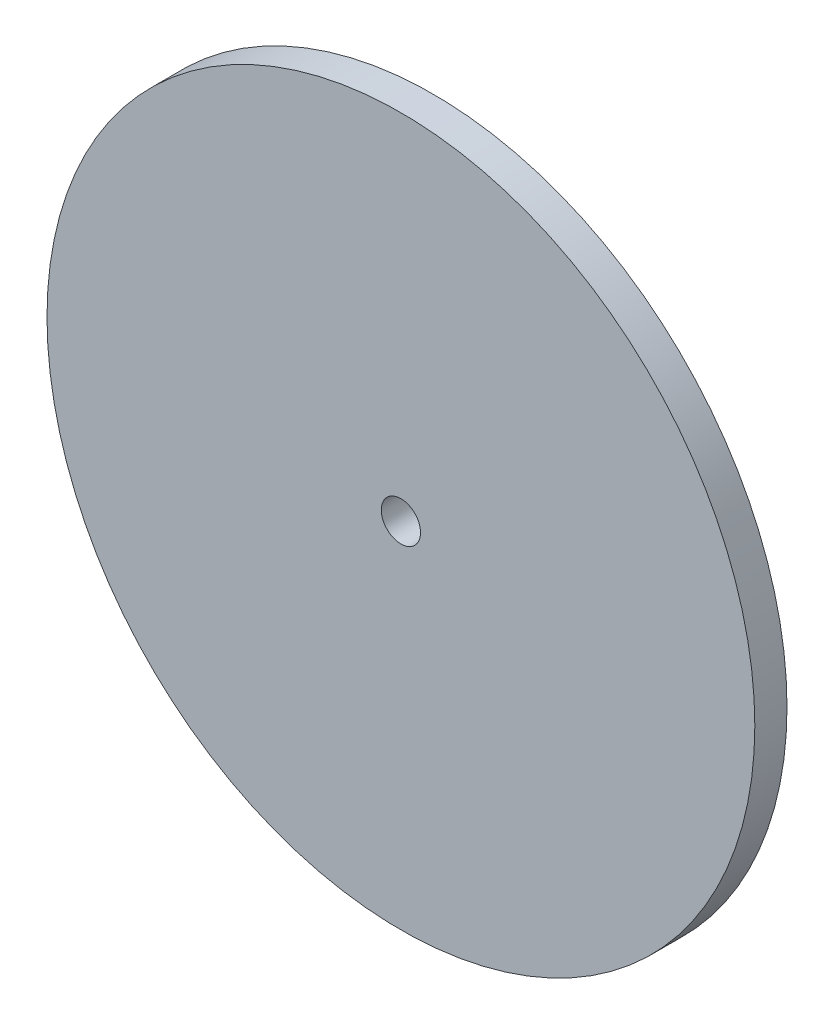
from build123d import *

# Parameters (mm, degrees)
SKETCH1_R           = 55
SKETCH1_R_2         = 3.05
BOSS_EXTRUDE1_DEPTH = 5


with BuildPart() as part:
    # Sketch1 → Boss-Extrude1 (new body)
    with BuildSketch(Plane.XY):
        Circle(SKETCH1_R)
        Circle(SKETCH1_R_2, mode=Mode.SUBTRACT)
    extrude(amount=BOSS_EXTRUDE1_DEPTH)


solid = part.part
